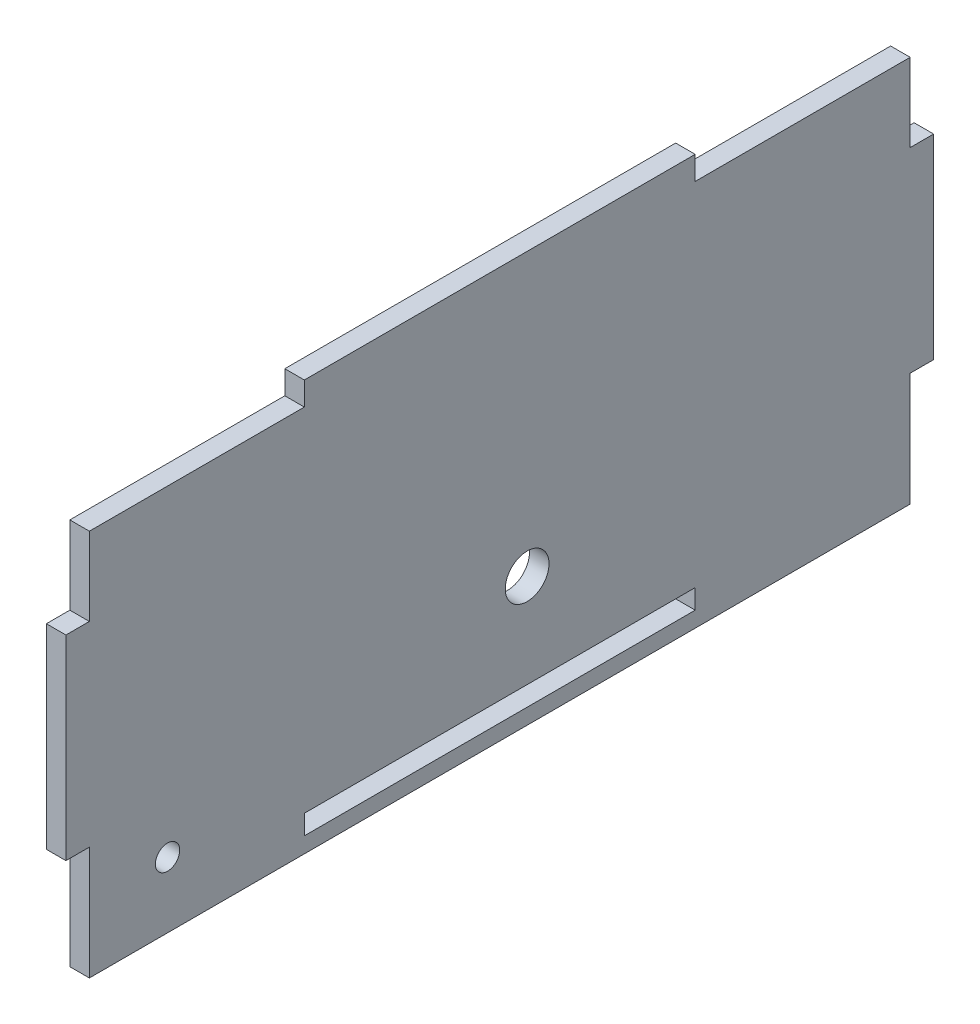
from build123d import *

# Parameters (mm, degrees)
SKETCH1_R           = 3.556
SKETCH1_R_2         = 1.9812
SKETCH1_W           = 63.5
SKETCH1_H           = 3.175
BOSS_EXTRUDE1_DEPTH = 3.175


with BuildPart() as part:
    # Sketch1 → Boss-Extrude1 (new body)
    with BuildSketch(Plane(origin=(0, 0, 0), x_dir=(0, 0, -1), z_dir=(1, 0, 0))):
        Polygon((-66.675, 28.575), (-31.75, 28.575), (-31.75, 32.385), (31.75, 32.385), (31.75, 28.575), (66.675, 28.575), (66.675, 15.875), (70.485, 15.875), (70.485, -15.875), (66.675, -15.875), (66.675, -34.29), (-66.675, -34.29), (-66.675, -15.875), (-70.485, -15.875), (-70.485, 15.875), (-66.675, 15.875), align=None)
        with Locations((4.445, -13.335)):
            Circle(SKETCH1_R, mode=Mode.SUBTRACT)
        with Locations((-53.975, -23.6347)):
            Circle(SKETCH1_R_2, mode=Mode.SUBTRACT)
        with Locations((0, -30.1625)):
            Rectangle(SKETCH1_W, SKETCH1_H, mode=Mode.SUBTRACT)
    extrude(amount=BOSS_EXTRUDE1_DEPTH)


solid = part.part
